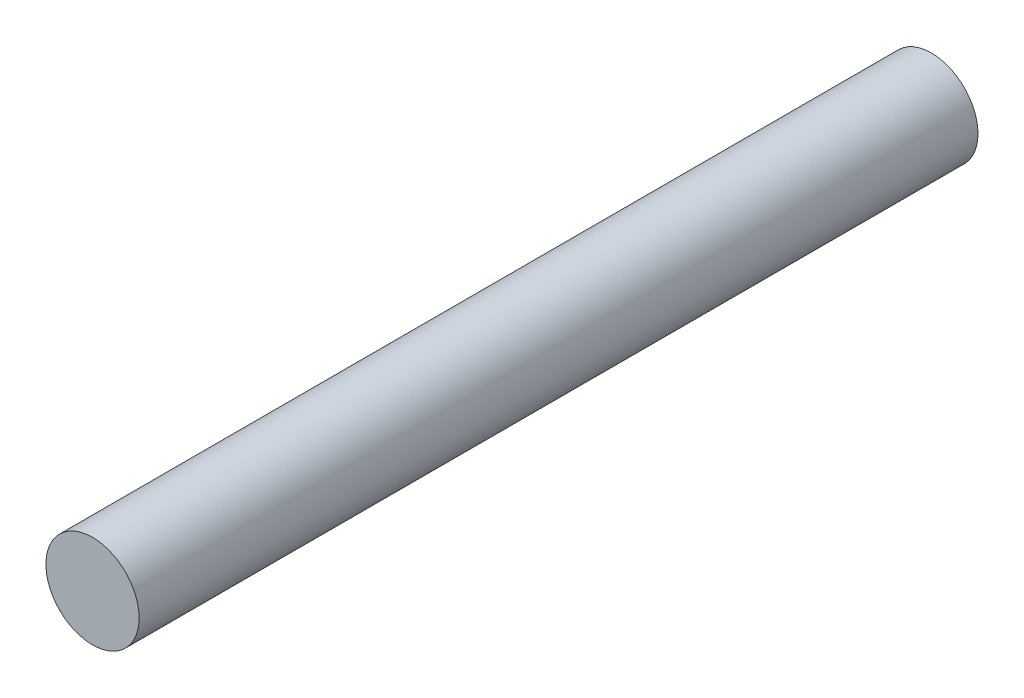
from build123d import *

# Parameters (mm, degrees)
SKETCH1_R           = 3
BOSS_EXTRUDE1_DEPTH = 54


with BuildPart() as part:
    # Sketch1 → Boss-Extrude1 (new body)
    with BuildSketch(Plane.XY):
        Circle(SKETCH1_R)
    extrude(amount=BOSS_EXTRUDE1_DEPTH)


solid = part.part
